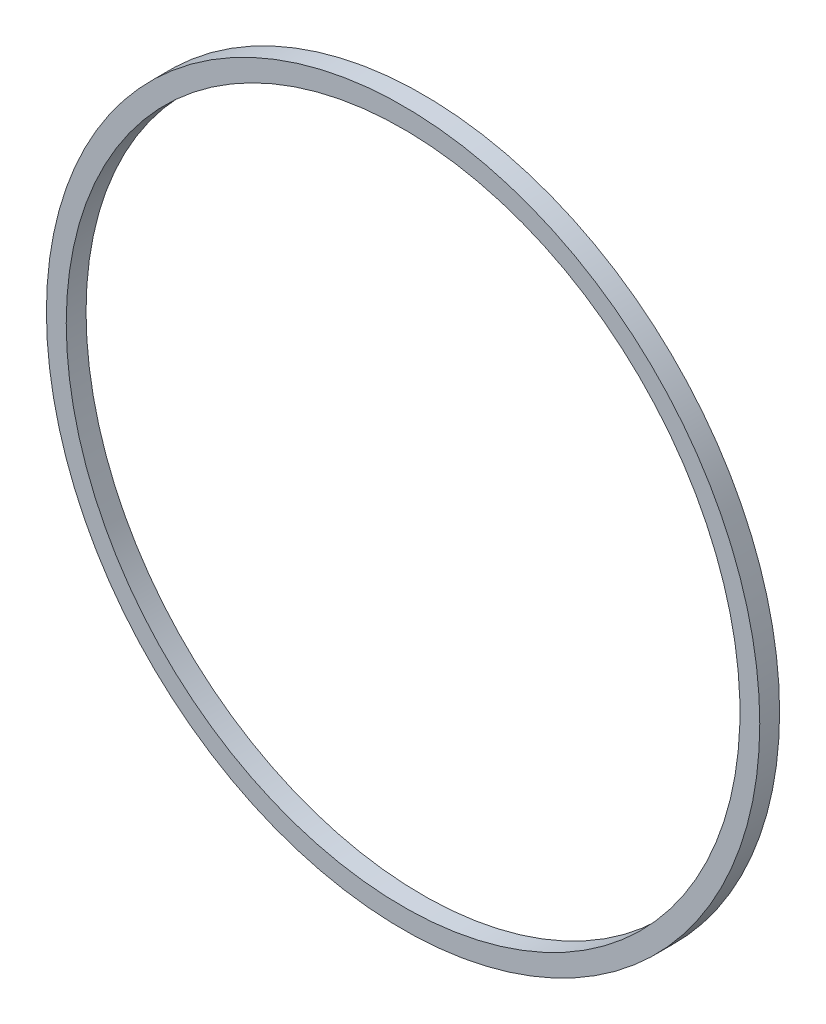
from build123d import *

# Parameters (mm, degrees)
SKETCH2_W = 38.1
SKETCH2_H = 38.1


with BuildPart() as part:
    # Sweep1: sweep along a path in Sketch1
    with BuildLine(Plane.XY) as sweep1_path:
        CenterArc((0, 0), 666.75, 0, 360)
    # Sketch2 → Sweep1 (sweep)
    with BuildSketch(Plane(origin=(0, 0, 0), x_dir=(1, 0, 0), z_dir=(0, 1, 0))):
        with Locations((-666.75, 0)):
            Rectangle(SKETCH2_W, SKETCH2_H)
    sweep(path=sweep1_path.line)


solid = part.part
